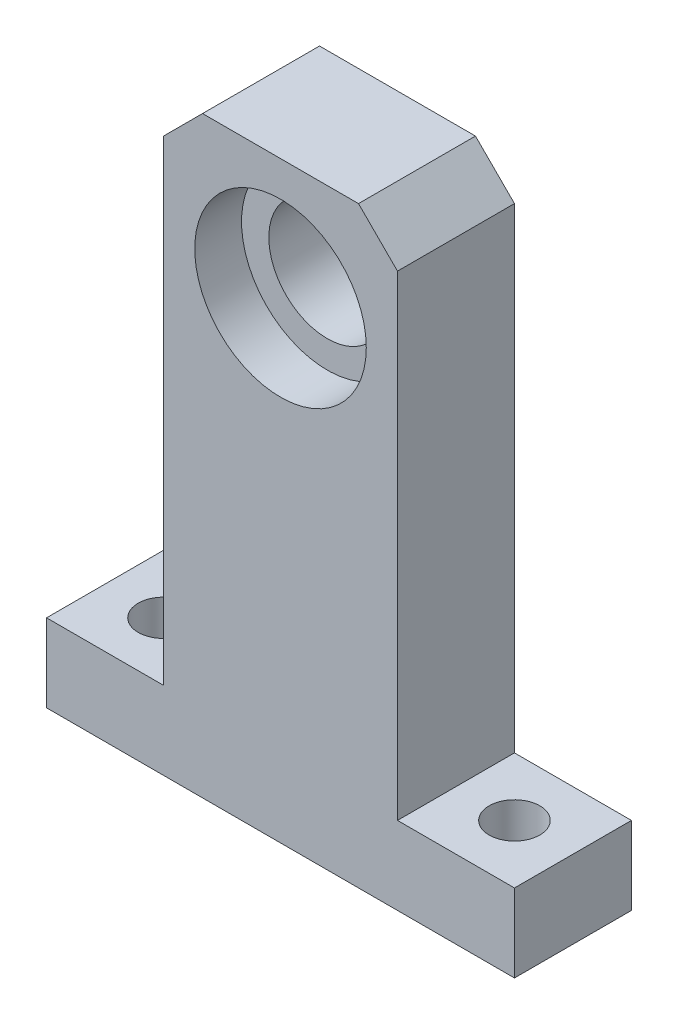
from build123d import *

# Parameters (mm, degrees)
SKETCH_1_W                  = 60
SKETCH_1_H                  = 76
EXTRUDE_1_DEPTH             = 7.5
SKETCH_2_W                  = 15
SKETCH_2_H                  = 66
CUT_EXTRUDE_2_DEPTH         = 51.68530359
CHAMFER_1_SIZE              = 5
HOLE_WIZARD_6_5_6_5_1_D     = 6.5
HOLE_WIZARD_6_5_6_5_1_DEPTH = 15
HOLE_WIZARD_6_5_6_5_1_TIP   = 1.952797012
SKETCH_6_R                  = 7.5
CUT_EXTRUDE_4_DEPTH         = 51.68530359
SKETCH_7_R                  = 11
CUT_EXTRUDE_5_DEPTH         = 6


with BuildPart() as part:
    # 草图1 → 拉伸1 (new, symmetric)
    with BuildSketch(Plane.XY):
        Rectangle(SKETCH_1_W, SKETCH_1_H)
    extrude(amount=EXTRUDE_1_DEPTH, both=True)

    # 草图2 → 拉伸2 (cut, through all)
    with BuildSketch(Plane.XY.offset(7.5)):
        with Locations((-22.5, 5)):
            Rectangle(SKETCH_2_W, SKETCH_2_H)
        with Locations((22.5, 5)):
            Rectangle(SKETCH_2_W, SKETCH_2_H)
    extrude(amount=-CUT_EXTRUDE_2_DEPTH, mode=Mode.SUBTRACT)

    # 倒角1
    chamfer_1_edges = [part.edges().sort_by_distance(p)[0] for p in [
        (-15, 38, 0),
        (15, 38, 0),
    ]]
    chamfer(chamfer_1_edges, length=CHAMFER_1_SIZE)

    # Ø6.5 (6.5) 直径孔1
    with Locations(Plane.XZ.offset(38)):
        with Locations((-22.5, 0), (22.5, 0)):
            Hole(HOLE_WIZARD_6_5_6_5_1_D / 2, depth=HOLE_WIZARD_6_5_6_5_1_DEPTH)
            with Locations((0, 0, -(HOLE_WIZARD_6_5_6_5_1_DEPTH + HOLE_WIZARD_6_5_6_5_1_TIP / 2))):  # 118° drill point
                Cone(0, HOLE_WIZARD_6_5_6_5_1_D / 2, HOLE_WIZARD_6_5_6_5_1_TIP, mode=Mode.SUBTRACT)

    # 草图6 → 拉伸4 (cut, through all)
    with BuildSketch(Plane.XY.offset(7.5)):
        with Locations((0, 22.5)):
            Circle(SKETCH_6_R)
    extrude(amount=-CUT_EXTRUDE_4_DEPTH, mode=Mode.SUBTRACT)

    # 草图7 → 拉伸5 (cut)
    with BuildSketch(Plane.XY.offset(7.5)):
        with Locations((0, 22.5)):
            Circle(SKETCH_7_R)
    extrude(amount=-CUT_EXTRUDE_5_DEPTH, mode=Mode.SUBTRACT)


solid = part.part
